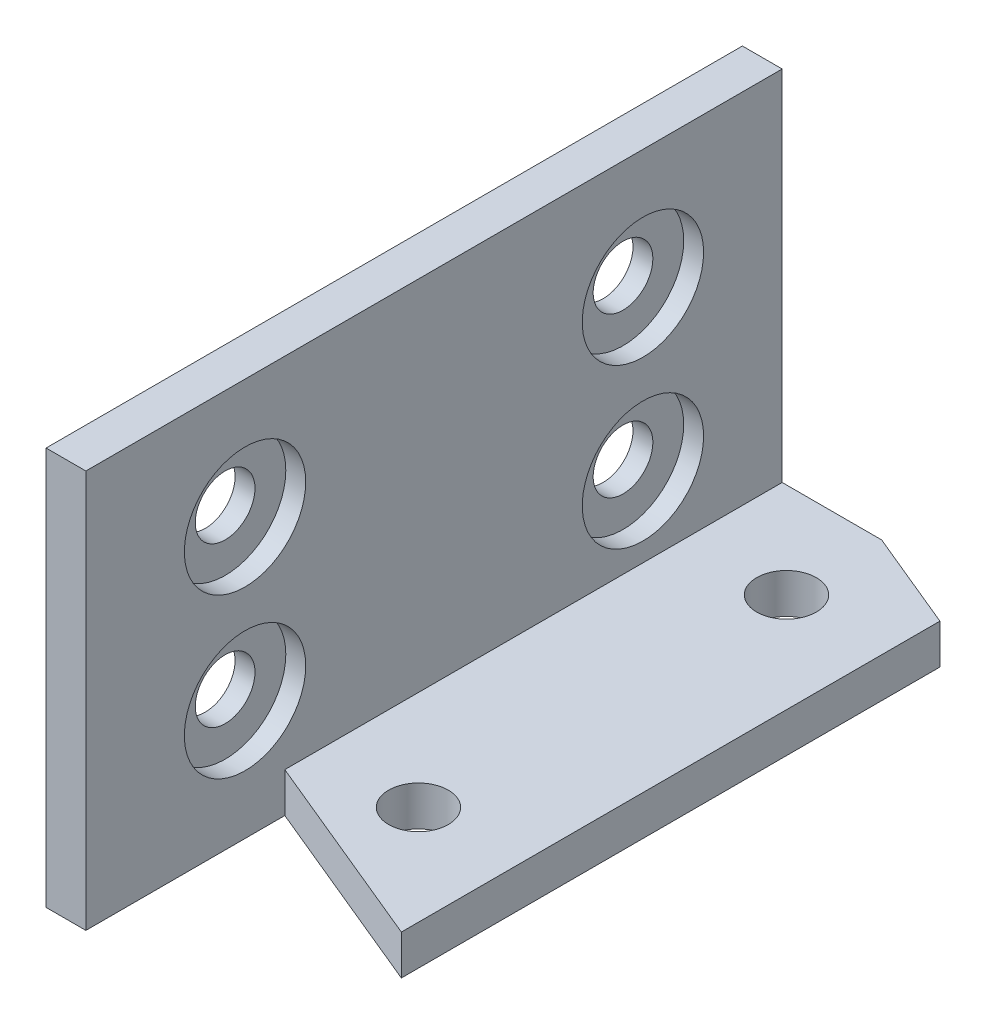
from build123d import *

# Parameters (mm, degrees)
SKETCH1_W           = 35
SKETCH1_H           = 20
BOSS_EXTRUDE1_DEPTH = 2
SKETCH3_R           = 1.5
CUT_EXTRUDE1_DEPTH  = 2
BOSS_EXTRUDE2_DEPTH = 2
SKETCH5_R           = 1.5
CUT_EXTRUDE2_DEPTH  = 2
SKETCH6_R           = 3.05
CUT_EXTRUDE3_DEPTH  = 1


with BuildPart() as part:
    # Sketch1 → Boss-Extrude1 (new body)
    with BuildSketch(Plane(origin=(0, 0, 0), x_dir=(0, 0, -1), z_dir=(1, 0, 0))):
        Rectangle(SKETCH1_W, SKETCH1_H)
    extrude(amount=BOSS_EXTRUDE1_DEPTH)

    # Sketch3 → Cut-Extrude1 (cut)
    with BuildSketch(Plane(origin=(2, 0, 0), x_dir=(0, 0, -1), z_dir=(1, 0, 0))):
        with Locations((10.5, 4)):
            Circle(SKETCH3_R)
        with Locations((10.5, -4)):
            Circle(SKETCH3_R)
        with Locations((-9.5, 4)):
            Circle(SKETCH3_R)
        with Locations((-9.5, -4)):
            Circle(SKETCH3_R)
    extrude(amount=-CUT_EXTRUDE1_DEPTH, mode=Mode.SUBTRACT)

    # Sketch4 → Boss-Extrude2 (add)
    with BuildSketch(Plane.XZ.offset(10)):
        Polygon((2, 7.5), (12, 11.642135624), (12, -15.428932188), (7, -17.5), (2, -17.5), align=None)
    extrude(amount=-BOSS_EXTRUDE2_DEPTH)

    # Sketch5 → Cut-Extrude2 (cut)
    with BuildSketch(Plane(origin=(0, -8, 0), x_dir=(1, 0, 0), z_dir=(0, 1, 0))):
        with Locations(Location((7, 12.717304889, 0), (0, 0, 270))):
            Circle(SKETCH5_R)
        with Locations(Location((7, -5.782695111, 0), (0, 0, 270))):
            Circle(SKETCH5_R)
    extrude(amount=-CUT_EXTRUDE2_DEPTH, mode=Mode.SUBTRACT)

    # Sketch6 → Cut-Extrude3 (cut)
    with BuildSketch(Plane(origin=(2, 0, 0), x_dir=(0, 0, -1), z_dir=(1, 0, 0))):
        with Locations((-9.5, 4)):
            Circle(SKETCH6_R)
        with Locations((-9.5, -4)):
            Circle(SKETCH6_R)
        with Locations((10.5, -4)):
            Circle(SKETCH6_R)
        with Locations((10.5, 4)):
            Circle(SKETCH6_R)
    extrude(amount=-CUT_EXTRUDE3_DEPTH, mode=Mode.SUBTRACT)


solid = part.part
